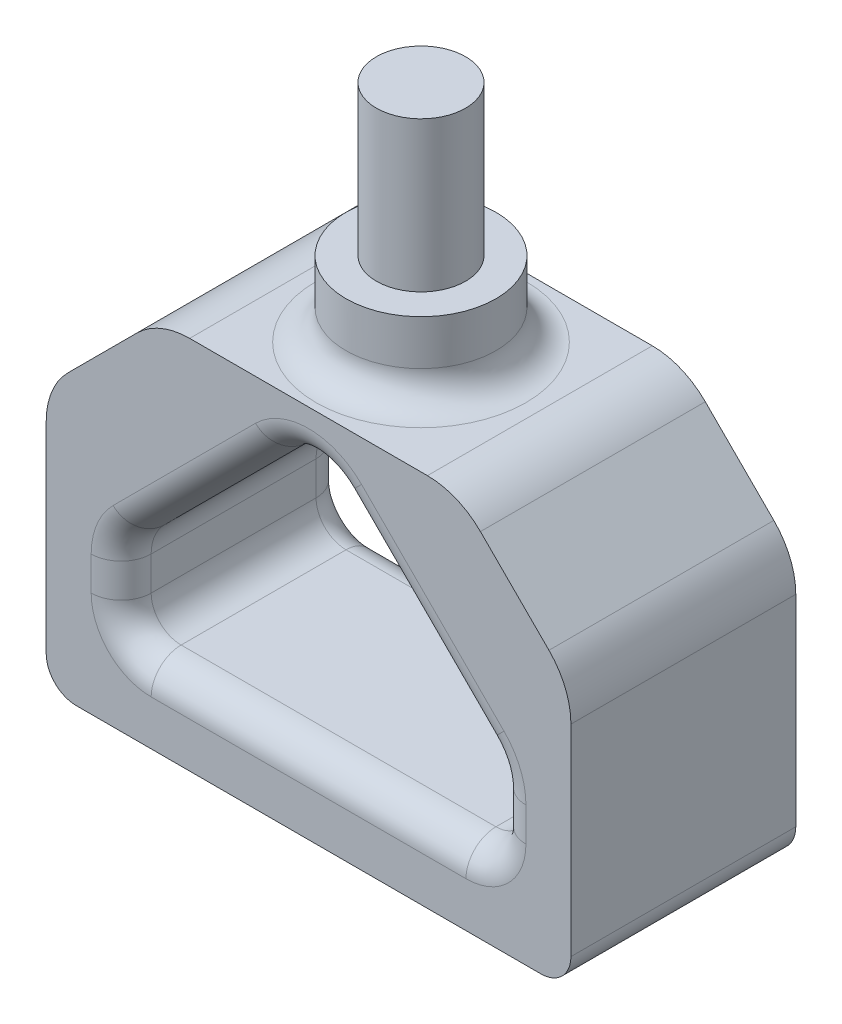
from build123d import *

# Parameters (mm, degrees)
SKETCH3_R           = 5
BOSS_EXTRUDE1_DEPTH = 5
SKETCH4_R           = 2.975
BOSS_EXTRUDE2_DEPTH = 10
BOSS_EXTRUDE5_DEPTH = 7.5
FILLET5_R           = 2
FILLET6_R           = 2


with BuildPart() as part:
    # Sketch3 → Boss-Extrude1 (new body)
    with BuildSketch(Plane(origin=(0, 0, 0), x_dir=(1, 0, 0), z_dir=(0, 1, 0))):
        with Locations(Location((0, 0, 0), (0, 0, 270))):
            Circle(SKETCH3_R)
    extrude(amount=BOSS_EXTRUDE1_DEPTH)

    # Sketch4 → Boss-Extrude2 (add)
    with BuildSketch(Plane(origin=(0, 5, 0), x_dir=(1, 0, 0), z_dir=(0, 1, 0))):
        with Locations(Location((0, 0, 0), (0, 0, 270))):
            Circle(SKETCH4_R)
    extrude(amount=BOSS_EXTRUDE2_DEPTH)

    # Sketch8 → Boss-Extrude5 (add, symmetric)
    with BuildSketch(Plane.XY):
        with BuildLine():
            Line((-15.5, -25), (15.5, -25))
            ThreePointArc((15.5, -25), (16.914213562, -24.414213562), (17.5, -23))
            Line((17.5, -23), (17.5, -9.571067812))
            ThreePointArc((17.5, -9.571067812), (17.119397663, -7.65765065), (16.035533906, -6.035533906))
            Line((16.035533906, -6.035533906), (11.464466094, -1.464466094))
            ThreePointArc((11.464466094, -1.464466094), (9.84234935, -0.380602337), (7.928932188, 0))
            Line((7.928932188, 0), (-7.928932188, 0))
            ThreePointArc((-7.928932188, 0), (-9.84234935, -0.380602337), (-11.464466094, -1.464466094))
            Line((-11.464466094, -1.464466094), (-16.035533906, -6.035533906))
            ThreePointArc((-16.035533906, -6.035533906), (-17.119397663, -7.65765065), (-17.5, -9.571067812))
            Line((-17.5, -9.571067812), (-17.5, -23))
            ThreePointArc((-17.5, -23), (-16.914213562, -24.414213562), (-15.5, -25))
        make_face()
        with BuildLine():
            Line((-12.5, -15.742640687), (-12.5, -18))
            ThreePointArc((-12.5, -18), (-11.914213562, -19.414213562), (-10.5, -20))
            Line((-10.5, -20), (10.5, -20))
            ThreePointArc((10.5, -20), (11.914213562, -19.414213562), (12.5, -18))
            Line((12.5, -18), (12.5, -15.742640687))
            ThreePointArc((12.5, -15.742640687), (12.271638598, -14.59459039), (11.621320344, -13.621320344))
            Line((11.621320344, -13.621320344), (2.121320344, -4.121320344))
            ThreePointArc((2.121320344, -4.121320344), (0, -3.242640687), (-2.121320344, -4.121320344))
            Line((-2.121320344, -4.121320344), (-11.621320344, -13.621320344))
            ThreePointArc((-11.621320344, -13.621320344), (-12.271638598, -14.59459039), (-12.5, -15.742640687))
        make_face(mode=Mode.SUBTRACT)
    extrude(amount=BOSS_EXTRUDE5_DEPTH, both=True)

    # Fillet5
    fillet5_edges = [part.edges().sort_by_distance(p)[0] for p in [
        (0, 0, -5),
    ]]
    fillet(fillet5_edges, radius=FILLET5_R)

    # Fillet6
    fillet6_edges = [part.edges().sort_by_distance(p)[0] for p in [
        (6.871320344, -8.871320344, -7.5),
        (0, -3.242640687, -7.5),
        (-6.871320344, -8.871320344, -7.5),
        (-12.271638598, -14.59459039, -7.5),
        (-12.5, -16.871320344, -7.5),
        (-11.914213562, -19.414213562, -7.5),
        (0, -20, -7.5),
        (11.914213562, -19.414213562, -7.5),
        (12.5, -16.871320344, -7.5),
        (12.271638598, -14.59459039, -7.5),
        (0, -3.242640687, 7.5),
        (-6.871320344, -8.871320344, 7.5),
        (-12.271638598, -14.59459039, 7.5),
        (-12.5, -16.871320344, 7.5),
        (-11.914213562, -19.414213562, 7.5),
        (0, -20, 7.5),
        (11.914213562, -19.414213562, 7.5),
        (12.5, -16.871320344, 7.5),
        (12.271638598, -14.59459039, 7.5),
        (6.871320344, -8.871320344, 7.5),
    ]]
    fillet(fillet6_edges, radius=FILLET6_R)


solid = part.part
